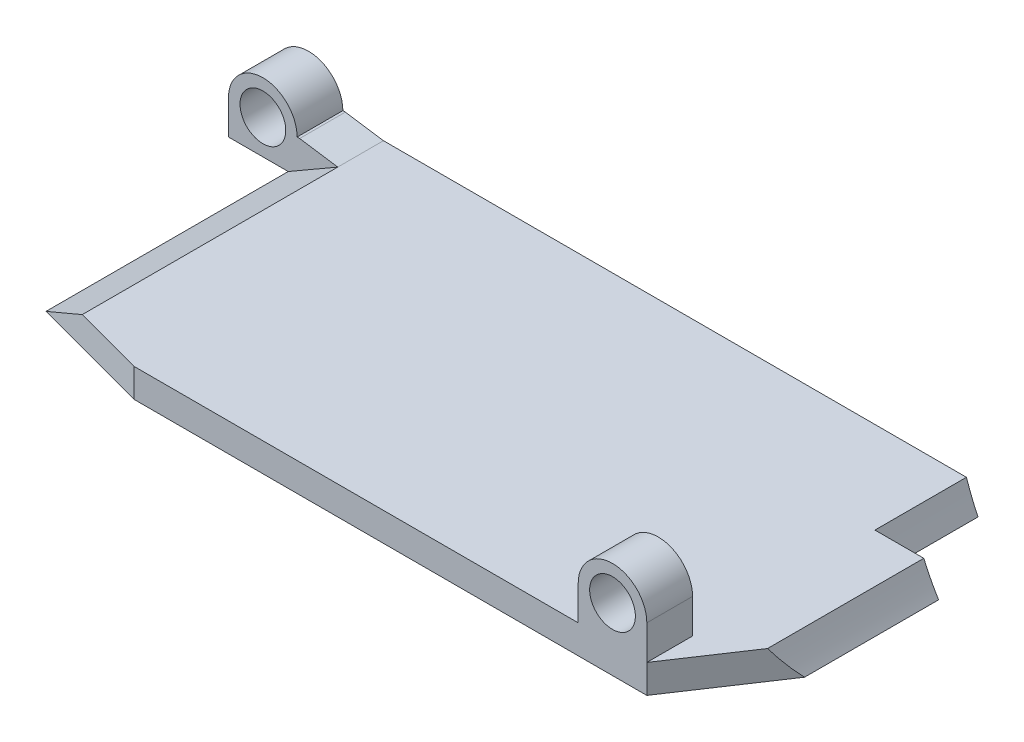
from build123d import *

# Parameters (mm, degrees)
EXTRUDE_1_DEPTH     = 14
CUT_EXTRUDE_1_DEPTH = 4
CUT_EXTRUDE_2_DEPTH = 23.370796565
EXTRUDE_2_DEPTH     = 2
EXTRUDE_3_DEPTH     = 2
MM_1_D              = 2
MM_2_D              = 2


with BuildPart() as part:
    # 草图2 → 凸台-拉伸1 (new body)
    with BuildSketch(Plane(origin=(0, 0, -2), x_dir=(-1, 0, 0), z_dir=(0, 0, -1))):
        with BuildLine():
            Line((-14.855557574, 24.75), (15.584929867, 24.75))
            Line((15.584929867, 24.75), (13.419866357, 26))
            Line((13.419866357, 26), (-14.208438024, 26))
            ThreePointArc((-14.208438024, 26), (-14.507523283, 25.36232965), (-14.855557574, 24.75))
        make_face()
    extrude(amount=EXTRUDE_1_DEPTH)

    # 草图3 → 切除-拉伸1 (cut)
    with BuildSketch(Plane(origin=(0, 0, -16), x_dir=(-1, 0, 0), z_dir=(0, 0, -1))):
        with BuildLine():
            Line((-12.578432584, 24.75), (-17.35825905, 24.75))
            Line((-17.35825905, 24.75), (-16.062803405, 32.25))
            Line((-16.062803405, 32.25), (-11.849295798, 32.25))
            ThreePointArc((-11.849295798, 32.25), (-11.55161702, 28.435617497), (-12.578432584, 24.75))
        make_face()
    extrude(amount=-CUT_EXTRUDE_1_DEPTH, mode=Mode.SUBTRACT)

    # 草图4 → 切除-拉伸2 (cut, through all)
    with BuildSketch(Plane.XZ.offset(-24.75)):
        Polygon((12.09629915, -2), (15.429632483, -7), (15.429632483, -2), align=None)
        Polygon((-10.329335075, -2), (-15.584929867, -3.40823238), (-15.584929867, -2), align=None)
    extrude(amount=-CUT_EXTRUDE_2_DEPTH, mode=Mode.SUBTRACT)

    # 草图6 → 凸台-拉伸2 (add)
    with BuildSketch(Plane(origin=(0, 0, -16), x_dir=(-1, 0, 0), z_dir=(0, 0, -1))):
        with BuildLine():
            Line((13.419866357, 26), (15.584929867, 24.75))
            Line((15.584929867, 24.75), (16.695744446, 24.75))
            ThreePointArc((16.695744446, 24.75), (15.635084274, 25.189339828), (15.195744446, 26.25))
            Line((15.195744446, 26.25), (15.085744446, 26.25))
            Line((15.085744446, 26.25), (13.419866357, 26))
        make_face()
        with BuildLine():
            ThreePointArc((15.195744446, 26.25), (15.635084274, 25.189339828), (16.695744446, 24.75))
            ThreePointArc((16.695744446, 24.75), (17.756404617, 25.189339828), (18.195744446, 26.25))
            Line((18.195744446, 26.25), (15.195744446, 26.25))
        make_face()
        with BuildLine():
            ThreePointArc((18.195744446, 26.25), (16.695744446, 27.75), (15.195744446, 26.25))
            Line((15.195744446, 26.25), (18.195744446, 26.25))
        make_face()
        with BuildLine():
            ThreePointArc((18.195744446, 26.25), (17.756404617, 25.189339828), (16.695744446, 24.75))
            Line((16.695744446, 24.75), (18.195744446, 24.75))
            Line((18.195744446, 24.75), (18.195744446, 26.25))
        make_face()
    extrude(amount=-EXTRUDE_2_DEPTH)

    # 草图7 → 凸台-拉伸3 (add)
    with BuildSketch(Plane.XY.offset(-2)):
        with BuildLine():
            Line((10.59629915, 26), (12.09629915, 26))
            Line((12.09629915, 26), (12.09629915, 27.5))
            ThreePointArc((12.09629915, 27.5), (11.656959321, 26.439339828), (10.59629915, 26))
        make_face()
        with BuildLine():
            Line((9.09629915, 26), (10.59629915, 26))
            ThreePointArc((10.59629915, 26), (9.535638978, 26.439339828), (9.09629915, 27.5))
            Line((9.09629915, 27.5), (9.09629915, 26))
        make_face()
        with BuildLine():
            ThreePointArc((10.59629915, 26), (11.656959321, 26.439339828), (12.09629915, 27.5))
            Line((12.09629915, 27.5), (9.09629915, 27.5))
            ThreePointArc((9.09629915, 27.5), (9.535638978, 26.439339828), (10.59629915, 26))
        make_face()
        with BuildLine():
            Line((9.09629915, 27.5), (12.09629915, 27.5))
            ThreePointArc((12.09629915, 27.5), (10.59629915, 29), (9.09629915, 27.5))
        make_face()
    extrude(amount=-EXTRUDE_3_DEPTH)

    # 大小mm 暗销孔1 (through all)
    with Locations(Plane(origin=(0, 0, -16), x_dir=(-1, 0, 0), z_dir=(0, 0, -1))):
        with Locations((16.691791053, 26.25)):
            Hole(MM_1_D / 2)

    # 大小mm 暗销孔2 (through all)
    with Locations(Plane.XY.offset(-2)):
        with Locations((10.59629915, 27.5)):
            Hole(MM_2_D / 2)


solid = part.part
